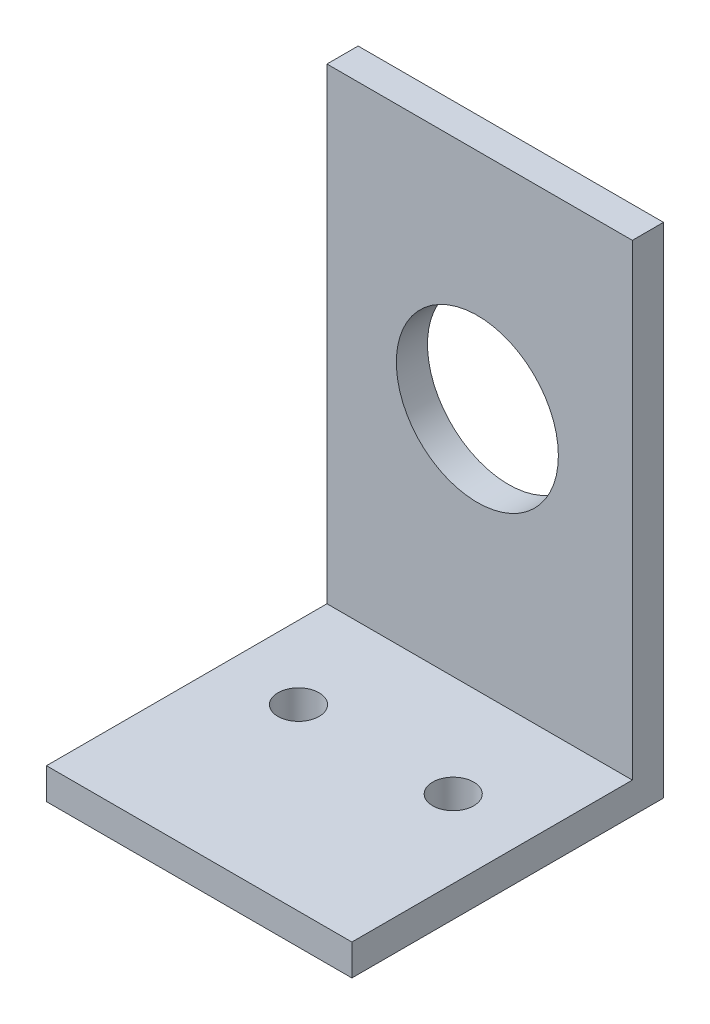
from build123d import *

# Parameters (mm, degrees)
ESQUISSE1_W             = 49
ESQUISSE1_H             = 80
BOSS_EXTRU_1_DEPTH      = 50
ESQUISSE2_W             = 73.004277741
ESQUISSE2_H             = 90.842499223
ENL_V_MAT_EXTRU_1_DEPTH = 101
D_GAGEMENT_M61_D        = 6.6
D_GAGEMENT_M241_D       = 26


with BuildPart() as part:
    # Esquisse1 → Boss.-Extru.1 (new body)
    with BuildSketch(Plane.XY):
        Rectangle(ESQUISSE1_W, ESQUISSE1_H)
    extrude(amount=BOSS_EXTRU_1_DEPTH)

    # Esquisse2 → Enlèv. mat.-Extru.1 (cut)
    with BuildSketch(Plane(origin=(24.5, 0, 0), x_dir=(0, 0, -1), z_dir=(1, 0, 0))):
        with Locations((-41.502138871, 10.421249612)):
            Rectangle(ESQUISSE2_W, ESQUISSE2_H)
    extrude(amount=-ENL_V_MAT_EXTRU_1_DEPTH, mode=Mode.SUBTRACT)

    # Dégagement M61 (through all)
    with Locations(Plane(origin=(0, -40, 0), x_dir=(-1, 0, 0), z_dir=(0, -1, 0))):
        with Locations((-12.051490403, -21.293816609), (12.769236225, -21.293816609)):
            Hole(D_GAGEMENT_M61_D / 2)

    # Dégagement M241 (through all)
    with Locations(Plane.XY.offset(5)):
        with Locations((-0.37, 4.133244148)):
            Hole(D_GAGEMENT_M241_D / 2)


solid = part.part
